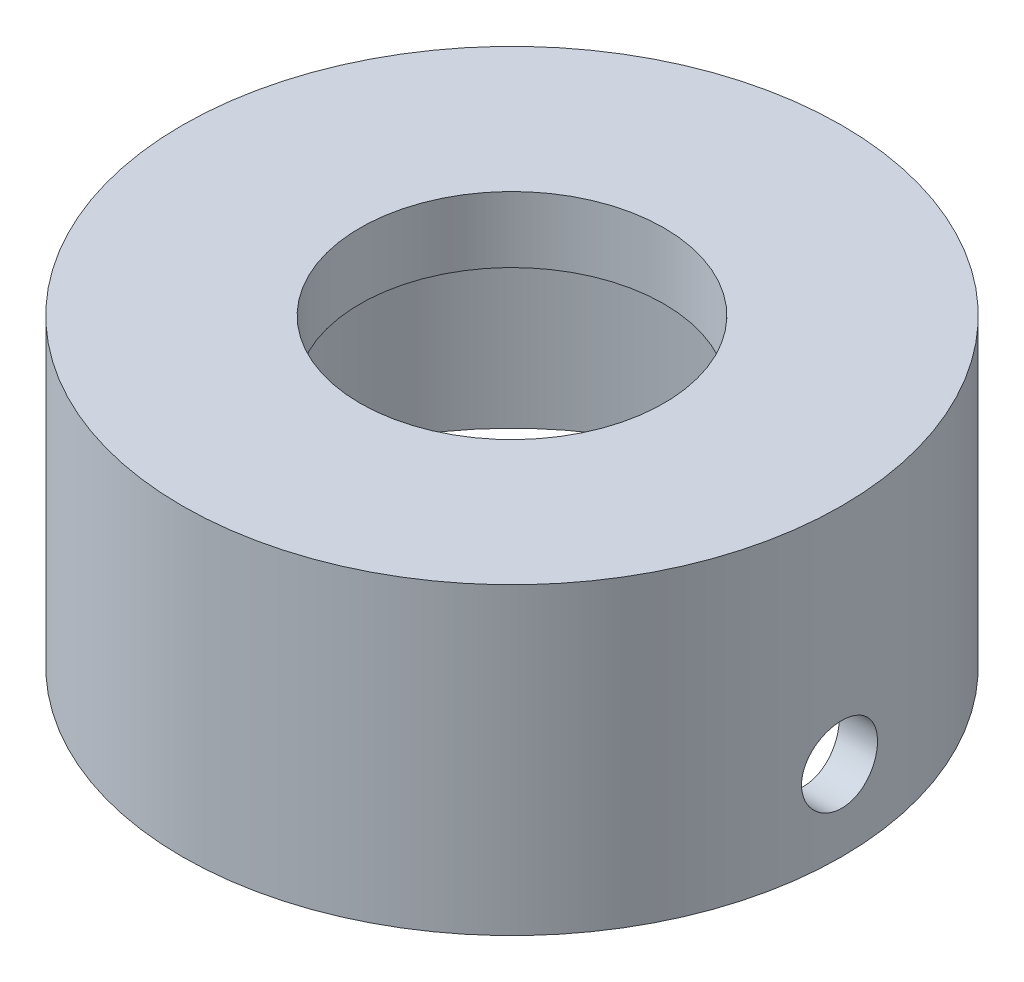
from build123d import *

# Parameters (mm, degrees)
SKETCH1_R               = 20.66925
BOSS_EXTRUDE1_DEPTH     = 19.05
SKETCH2_R               = 18.288
CUT_EXTRUDE1_DEPTH      = 13.3985
SKETCH3_R               = 9.525
CUT_EXTRUDE2_DEPTH      = 35.890375337
SKETCH4_R               = 15.875
CUT_EXTRUDE3_DEPTH      = 1.524
CUT_EXTRUDE4_DEPTH      = 35.890375337
CUT_EXTRUDE4_DEPTH_BACK = 35.890375337
SKETCH5_R               = 2.38125


with BuildPart() as part:
    # Sketch1 → Boss-Extrude1 (new body)
    with BuildSketch(Plane(origin=(0, 0, 0), x_dir=(1, 0, 0), z_dir=(0, 1, 0))):
        with Locations(Location((0, 0, 0), (0, 0, 270))):
            Circle(SKETCH1_R)
    extrude(amount=-BOSS_EXTRUDE1_DEPTH)

    # Sketch2 → Cut-Extrude1 (cut)
    with BuildSketch(Plane.XZ.offset(19.05)):
        with Locations(Location((0, 0, 0), (0, 0, 270))):
            Circle(SKETCH2_R)
    extrude(amount=-CUT_EXTRUDE1_DEPTH, mode=Mode.SUBTRACT)

    # Sketch3 → Cut-Extrude2 (cut, through all)
    with BuildSketch(Plane(origin=(0, 0, 0), x_dir=(1, 0, 0), z_dir=(0, 1, 0))):
        with Locations(Location((0, 0, 0), (0, 0, 270))):
            Circle(SKETCH3_R)
    extrude(amount=-CUT_EXTRUDE2_DEPTH, mode=Mode.SUBTRACT)

    # Sketch4 → Cut-Extrude3 (cut)
    with BuildSketch(Plane.XZ.offset(5.6515)):
        with Locations(Location((0, 0, 0), (0, 0, 270))):
            Circle(SKETCH4_R)
    extrude(amount=-CUT_EXTRUDE3_DEPTH, mode=Mode.SUBTRACT)

    # Sketch5 → Cut-Extrude4 (cut, two sides: drawn at the far end of the back side and taken through both)
    with BuildSketch(Plane(origin=(0, 0, 0), x_dir=(0, 0, -1), z_dir=(1, 0, 0)).offset(-CUT_EXTRUDE4_DEPTH_BACK)):
        with Locations((0, -14.0335)):
            Circle(SKETCH5_R)
    extrude(amount=CUT_EXTRUDE4_DEPTH + CUT_EXTRUDE4_DEPTH_BACK, mode=Mode.SUBTRACT)


solid = part.part
